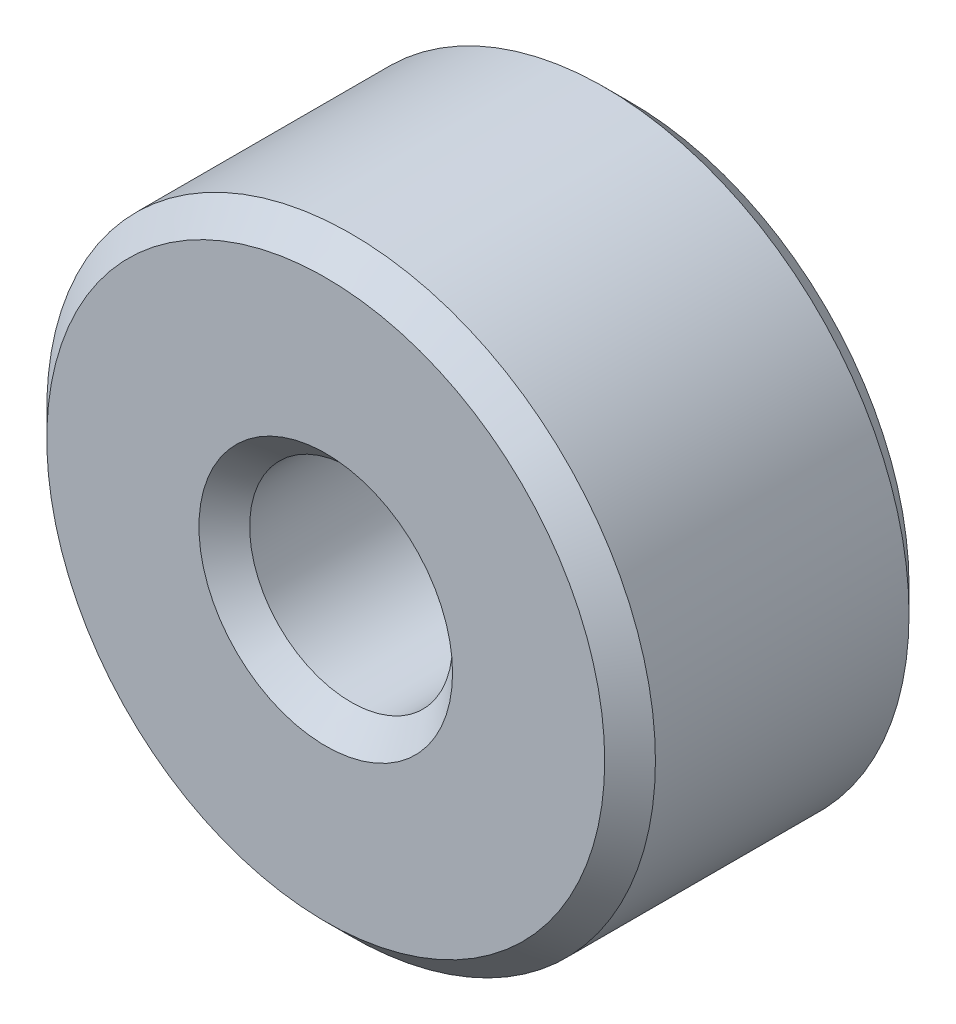
from build123d import *

# Parameters (mm, degrees)
SKETCH_1_R      = 3
SKETCH_1_R_2    = 1
EXTRUDE_1_DEPTH = 3
CHAMFER_1_SIZE  = 0.25


with BuildPart() as part:
    # 草图1 → 拉伸-薄壁1 (new body)
    with BuildSketch(Plane.XY):
        Circle(SKETCH_1_R)
        Circle(SKETCH_1_R_2, mode=Mode.SUBTRACT)
    extrude(amount=EXTRUDE_1_DEPTH)

    # 倒角1
    chamfer_1_edges = [part.edges().sort_by_distance(p)[0] for p in [
        (-3, 0, 0),
        (-1, 0, 0),
        (-3, 0, 3),
        (-1, 0, 3),
    ]]
    chamfer(chamfer_1_edges, length=CHAMFER_1_SIZE)


solid = part.part
